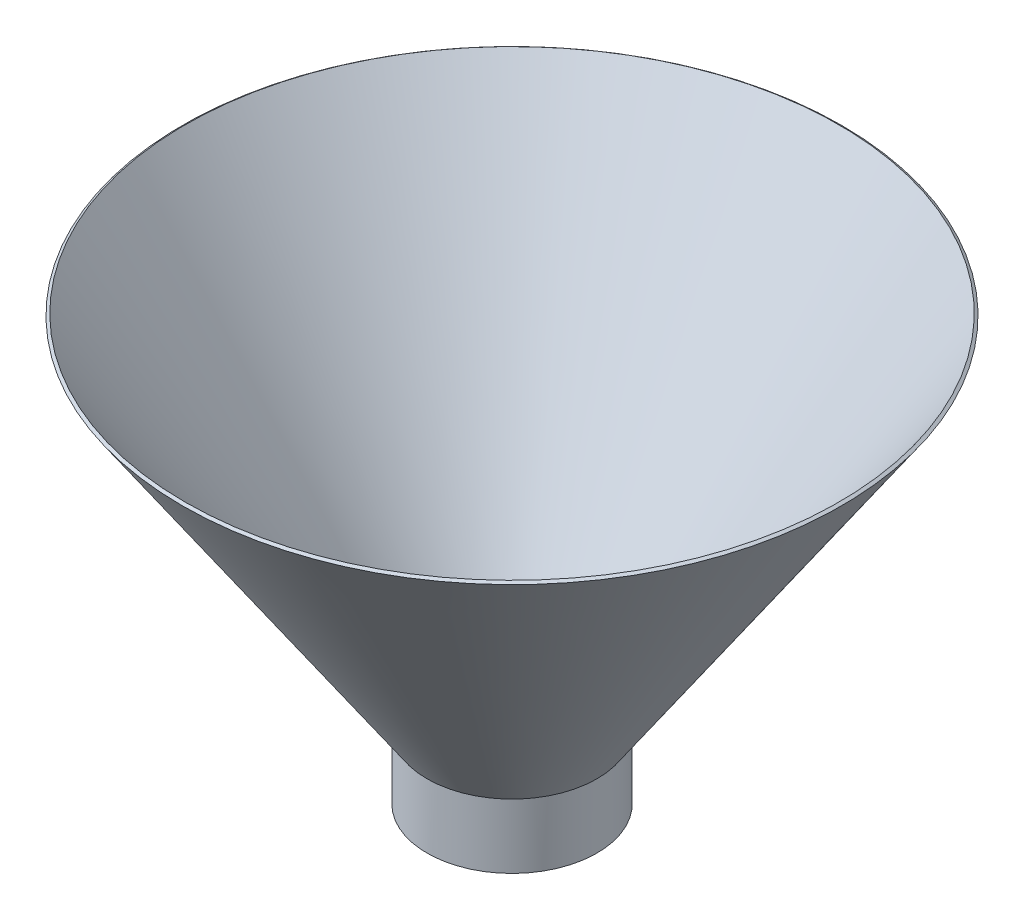
from build123d import *

# Parameters (mm, degrees)
THICKEN1_T1 = 2


with BuildPart() as body_1:
    # Surface-Revolve1: a surface, the sketch's curves turned about an axis
    with BuildLine(Plane.XY, mode=Mode.PRIVATE) as surface_revolve1_1_path:
        Line((200, 260), (50, 40))
        Line((50, 40), (50, 0))
    surface_revolve1_1 = Shell.revolve(surface_revolve1_1_path.wire(), 360, Axis((0, 324.346324007, 0), (0, -1, 0)))
    add(Solid.thicken(surface_revolve1_1, THICKEN1_T1))


solid = body_1.part
